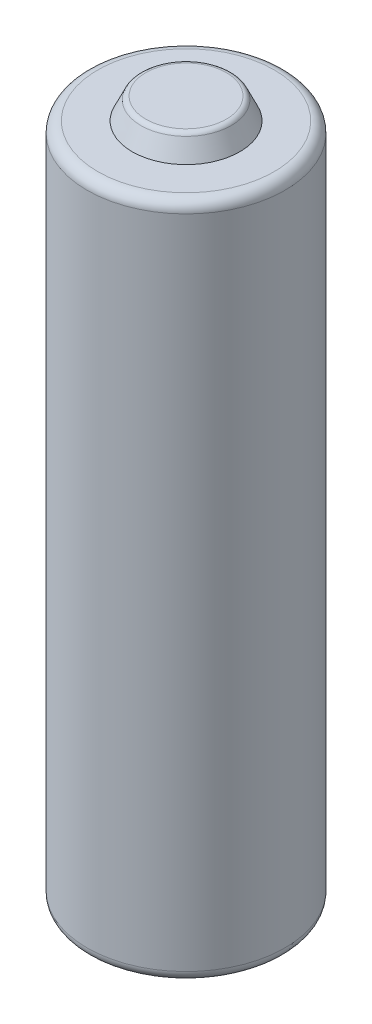
from build123d import *

# Parameters (mm, degrees)
SKETCH1_R           = 9.2
BOSS_EXTRUDE1_DEPTH = 63
SKETCH2_R           = 4.997387286
BOSS_EXTRUDE2_DEPTH = 2
BOSS_EXTRUDE2_TAPER = 25
SKETCH3_R           = 7.00167494
SKETCH3_R_2         = 6.004433393
CUT_EXTRUDE1_DEPTH  = 3
CUT_EXTRUDE1_TAPER  = 25
FILLET1_R           = 1
FILLET2_R           = 0.5
FILLET3_R           = 1


with BuildPart() as part:
    # Sketch1 → Boss-Extrude1 (new body)
    with BuildSketch(Plane(origin=(0, 0, 0), x_dir=(1, 0, 0), z_dir=(0, 1, 0))):
        with Locations(Location((0, 0, 0), (0, 0, 270))):
            Circle(SKETCH1_R)
    extrude(amount=BOSS_EXTRUDE1_DEPTH)

    # Sketch2 → Boss-Extrude2 (add)
    with BuildSketch(Plane(origin=(0, 63, 0), x_dir=(1, 0, 0), z_dir=(0, 1, 0))):
        Circle(SKETCH2_R)
    extrude(amount=BOSS_EXTRUDE2_DEPTH, taper=BOSS_EXTRUDE2_TAPER)

    # Sketch3 → Cut-Extrude1 (cut)
    with BuildSketch(Plane.XZ):
        Circle(SKETCH3_R)
        Circle(SKETCH3_R_2, mode=Mode.SUBTRACT)
    extrude(amount=-CUT_EXTRUDE1_DEPTH, taper=CUT_EXTRUDE1_TAPER, mode=Mode.SUBTRACT)

    # Fillet1
    fillet1_edges = [part.edges().sort_by_distance(p)[0] for p in [
        (0, 63, -9.2),
    ]]
    fillet(fillet1_edges, radius=FILLET1_R)

    # Fillet2
    fillet2_edges = [part.edges().sort_by_distance(p)[0] for p in [
        (-4.064771969, 65, 0),
    ]]
    fillet(fillet2_edges, radius=FILLET2_R)

    # Fillet3
    fillet3_edges = [part.edges().sort_by_distance(p)[0] for p in [
        (0, 0, -9.2),
    ]]
    fillet(fillet3_edges, radius=FILLET3_R)


solid = part.part
